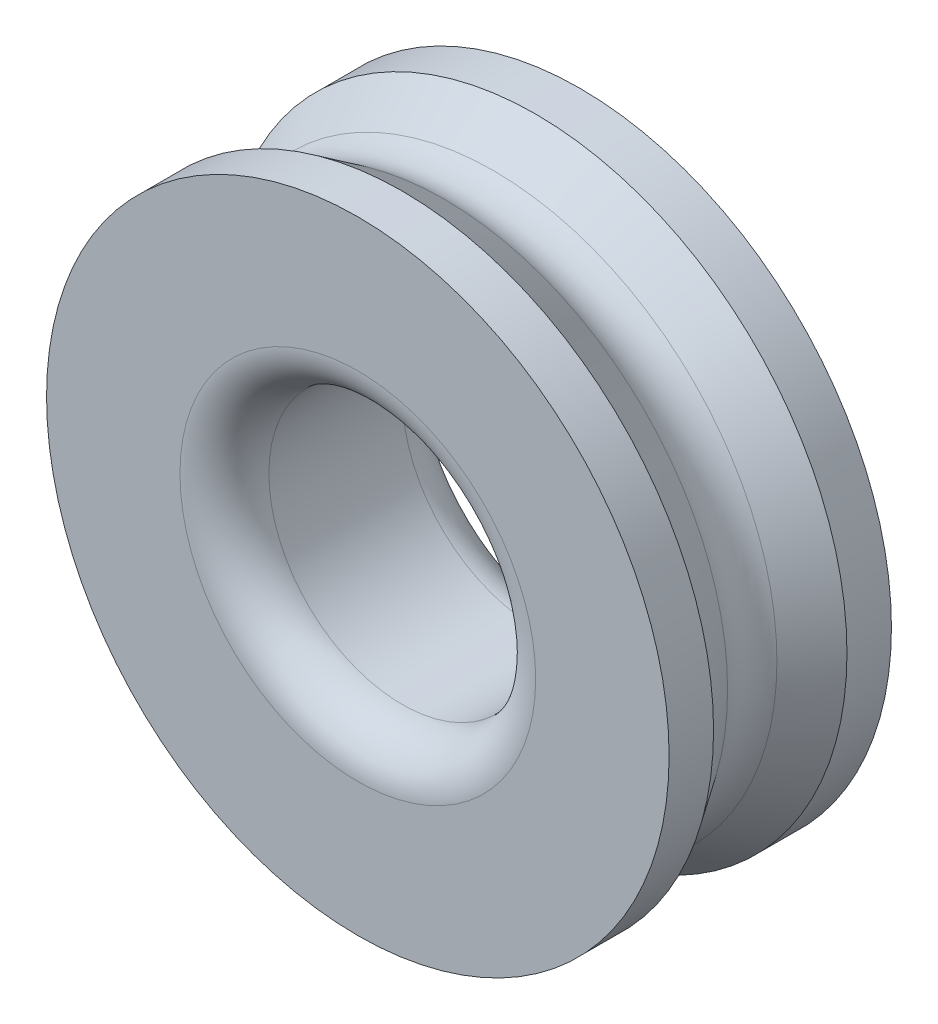
from build123d import *

# Parameters (mm, degrees)
SKETCH_3_R          = 7
EXTRUDE_1_DEPTH     = 1
EXTRUDE_START       = 1
SKETCH_4_R          = 7
EXTRUDE_2_DEPTH     = 1
SKETCH_5_R          = 3
CUT_EXTRUDE_3_DEPTH = 12.090536506
FILLET_2_R          = 1
FILLET_3_R          = 1


with BuildPart() as part:
    # Эскиз2 → Повернуть1 (revolve)
    with BuildSketch(Plane(origin=(0, 0, 0), x_dir=(1, 0, 0), z_dir=(0, 1, 0))):
        Polygon((7, 0), (0, 0), (0, 3), (7, 3), (6, 1.5), align=None)
    revolve(axis=Axis((0, 0, 0), (0, 0, -1)))

    # Эскиз3 → Вытянуть1 (add)
    with BuildSketch(Plane(origin=(0, 0, -3), x_dir=(-1, 0, 0), z_dir=(0, 0, -1))):
        Circle(SKETCH_3_R)
    extrude(amount=EXTRUDE_1_DEPTH)

    # Эскиз4 → Вытянуть2 (add)
    with BuildSketch(Plane.XY.offset(EXTRUDE_START)):
        with Locations(Location((0, 0, 0), (0, 0, 180))):
            Circle(SKETCH_4_R)
    extrude(amount=-EXTRUDE_2_DEPTH)

    # Эскиз5 → Вытянуть3 (cut, through all)
    with BuildSketch(Plane(origin=(0, 0, -4), x_dir=(-1, 0, 0), z_dir=(0, 0, -1))):
        Circle(SKETCH_5_R)
    extrude(amount=-CUT_EXTRUDE_3_DEPTH, mode=Mode.SUBTRACT)

    # Скругление2
    fillet_2_edges = [part.edges().sort_by_distance(p)[0] for p in [
        (-6, 0, -1.5),
    ]]
    fillet(fillet_2_edges, radius=FILLET_2_R)

    # Скругление3
    fillet_3_edges = [part.edges().sort_by_distance(p)[0] for p in [
        (3, 0, 1),
        (3, 0, -4),
    ]]
    fillet(fillet_3_edges, radius=FILLET_3_R)


solid = part.part
